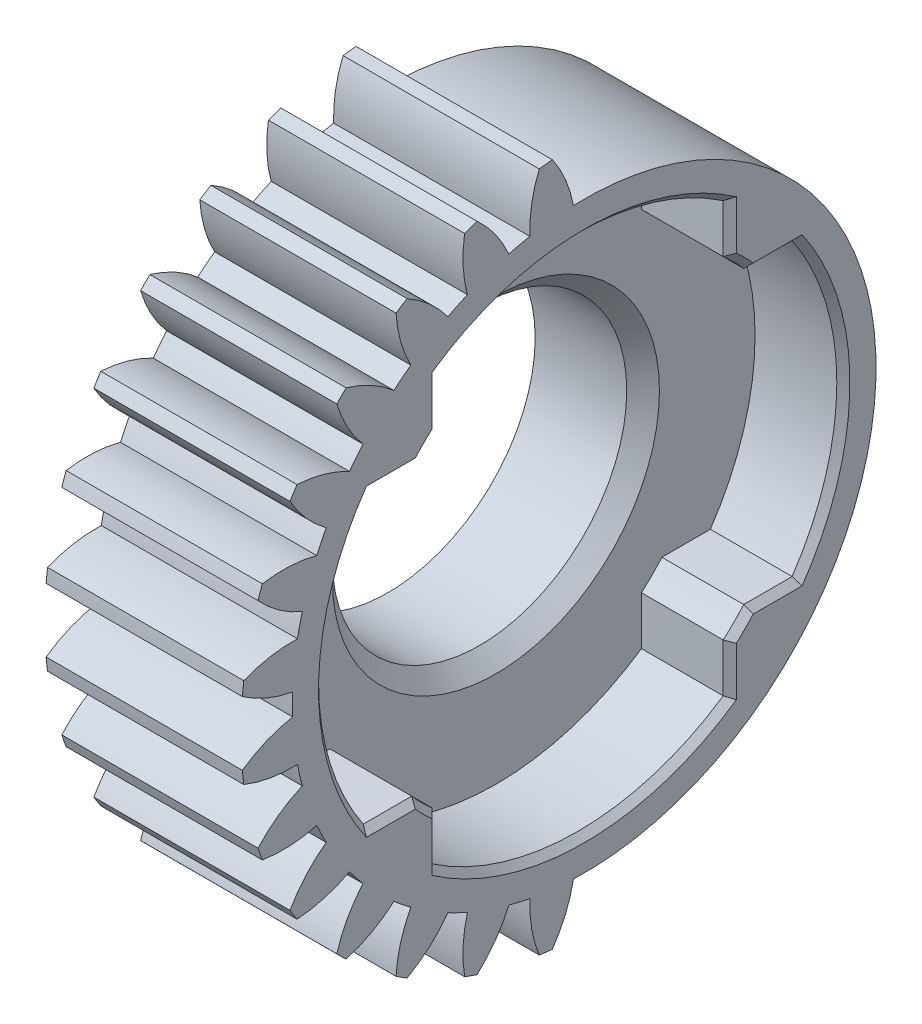
from build123d import *
from build123d.topology import SkipClean

# Parameters (mm, degrees)
BASPROSKE_W                     = 6
BASPROSKE_H                     = 10.5
TOOTHCUT_DEPTH                  = 17.015617378
TEETHCUTS_COUNT                 = 28
TEETHCUTS_ANGLE                 = 347.142857143
BORSKE_R                        = 1.5
BORE_DEPTH                      = 50.0000508
SZKIC1_R                        = 6.75
WYTNIJ_WYCI_GNI_CIE1_DEPTH      = 2.7
SZKIC2_R                        = 4.5
WYTNIJ_WYCI_GNI_CIE2_DEPTH      = 16.148783562
SZKIC3_W                        = 8.9
SZKIC3_H                        = 2.106468257
SZKIC3_W_2                      = 2.106468257
SZKIC3_H_2                      = 8.9
WYTNIJ_WYCI_GNI_CIE3_DEPTH      = 2.7
WYTNIJ_WYCI_GNI_CIE4_DEPTH      = 16.148783562
WYTNIJ_WYCI_GNI_CIE4_DEPTH_BACK = 16.148783562
SFAZOWANIE1_SIZE                = 0.2
SFAZOWANIE2_SIZE                = 0.5


with BuildPart() as part:
    # BasProSke → Base-Revolve (revolve)
    with BuildSketch(Plane(origin=(0, 0, 0), x_dir=(1, 0, 0), z_dir=(0, 1, 0)), mode=Mode.PRIVATE) as base_revolve_sk:
        with Locations((3, 5.25)):
            Rectangle(BASPROSKE_W, BASPROSKE_H)
    revolve(base_revolve_sk.sketch.rotate(Axis((-10, 0, 0), (1, 0, 0)), 180), axis=Axis((-10, 0, 0), (1, 0, 0)))

    # TooCutSke → ToothCut (cut, through all)
    with BuildSketch(Plane(origin=(0, 0, 0), x_dir=(0, 0, -1), z_dir=(1, 0, 0))):
        with BuildLine():
            ThreePointArc((0.330517784, 8.917877213), (0, 8.924), (-0.330517784, 8.917877213))
            ThreePointArc((-0.330517784, 8.917877213), (-0.576240803, 9.73440515), (-0.992712377, 10.478481154))
            ThreePointArc((-0.992712377, 10.478481154), (0, 10.5254), (0.992712377, 10.478481154))
            ThreePointArc((0.992712377, 10.478481154), (0.576240803, 9.73440515), (0.330517784, 8.917877213))
        make_face()
    toothcut = extrude(amount=TOOTHCUT_DEPTH, mode=Mode.SUBTRACT)

    # TeethCuts: ToothCut ×28 about axis
    teethcuts_axis = Axis((-10, 0, 0), (1, 0, 0))
    for i in range(1, TEETHCUTS_COUNT):
        add(toothcut.rotate(teethcuts_axis, i * TEETHCUTS_ANGLE / (TEETHCUTS_COUNT - 1)), mode=Mode.SUBTRACT)

    # BorSke → Bore (cut, symmetric)
    with BuildSketch(Plane(origin=(0, 0, 0), x_dir=(0, 0, -1), z_dir=(1, 0, 0))):
        with Locations(Location((0, 0, 0), (0, 0, 180))):
            Circle(BORSKE_R)
    extrude(amount=BORE_DEPTH, both=True, mode=Mode.SUBTRACT)

    # Szkic1 → Wytnij-wyciągnięcie1 (cut)
    with BuildSketch(Plane(origin=(6, 0, 0), x_dir=(0, 0, -1), z_dir=(1, 0, 0))):
        Circle(SZKIC1_R)
    extrude(amount=-WYTNIJ_WYCI_GNI_CIE1_DEPTH, mode=Mode.SUBTRACT)

    # Szkic2 → Wytnij-wyciągnięcie2 (cut, through all)
    with BuildSketch(Plane(origin=(3.3, 0, 0), x_dir=(0, 0, -1), z_dir=(1, 0, 0))):
        Circle(SZKIC2_R)
    extrude(amount=-WYTNIJ_WYCI_GNI_CIE2_DEPTH, mode=Mode.SUBTRACT)

    # Szkic3 → Wytnij-wyciągnięcie3 (cut)
    with BuildSketch(Plane(origin=(6, 0, 0), x_dir=(0, 0, -1), z_dir=(1, 0, 0))):
        with Locations((0, 5.503234129)):
            Rectangle(SZKIC3_W, SZKIC3_H)
        with Locations((-5.503234129, 0)):
            Rectangle(SZKIC3_W_2, SZKIC3_H_2)
        with BuildLine():
            ThreePointArc((-6.556468257, 4.45), (-7.924, 0), (-6.556468257, -4.45))
            Line((-6.556468257, -4.45), (-6.556468257, 4.45))
        make_face()
        with BuildLine():
            Line((-4.45, 6.556468257), (4.45, 6.556468257))
            ThreePointArc((4.45, 6.556468257), (0, 7.924), (-4.45, 6.556468257))
        make_face()
        with BuildLine():
            Line((6.556468257, 4.45), (6.556468257, -4.45))
            ThreePointArc((6.556468257, -4.45), (7.574405273, -2.327694303), (7.924, 0))
            ThreePointArc((7.924, 0), (7.574405273, 2.327694303), (6.556468257, 4.45))
        make_face()
        with Locations((5.503234129, 0)):
            Rectangle(SZKIC3_W_2, SZKIC3_H_2)
        with BuildLine():
            ThreePointArc((-4.45, -6.556468257), (0, -7.924), (4.45, -6.556468257))
            Line((4.45, -6.556468257), (-4.45, -6.556468257))
        make_face()
        with Locations((0, -5.503234129)):
            Rectangle(SZKIC3_W, SZKIC3_H)
    extrude(amount=-WYTNIJ_WYCI_GNI_CIE3_DEPTH, mode=Mode.SUBTRACT)

    # Szkic4 → Wytnij-wyciągnięcie4 (cut, two sides: drawn at the far end of the back side and taken through both)
    with SkipClean():  # the faces are left unmerged after this step: merging them gives an invalid solid
        with BuildSketch(Plane(origin=(3.3, 0, 0), x_dir=(0, 0, -1), z_dir=(1, 0, 0)).offset(-WYTNIJ_WYCI_GNI_CIE4_DEPTH_BACK)):
            with BuildLine():
                Line((0, 10.924), (0, 8.924))
                ThreePointArc((0, 8.924), (8.924, 0), (0, -8.924))
                Line((0, -8.924), (0, -10.924))
                ThreePointArc((0, -10.924), (10.924, 0), (0, 10.924))
            make_face()
        extrude(amount=WYTNIJ_WYCI_GNI_CIE4_DEPTH + WYTNIJ_WYCI_GNI_CIE4_DEPTH_BACK, mode=Mode.SUBTRACT)

    # Sfazowanie1
    sfazowanie1_edges = [part.edges().sort_by_distance(p)[0] for p in [
        (6, 4.772970773, -4.772970773),
        (6, -4.772970773, 4.772970773),
        (6, 4.45, 5.815949636),
        (6, 0, 7.924),
        (6, -4.45, 5.815949636),
        (6, 4.45, -5.815949636),
        (6, 0, -7.924),
        (6, -4.45, -5.815949636),
        (6, 4.772970773, 4.772970773),
        (6, 5.815949636, -4.45),
        (6, 7.924, 0),
        (6, 5.815949636, 4.45),
        (6, -4.772970773, -4.772970773),
        (6, -5.815949636, -4.45),
        (6, -7.924, 0),
        (6, -5.815949636, 4.45),
    ]]
    chamfer(sfazowanie1_edges, length=SFAZOWANIE1_SIZE)

    # Sfazowanie2
    sfazowanie2_edges = [part.edges().sort_by_distance(p)[0] for p in [
        (3.3, 0, 4.5),
    ]]
    chamfer(sfazowanie2_edges, length=SFAZOWANIE2_SIZE)


solid = part.part
